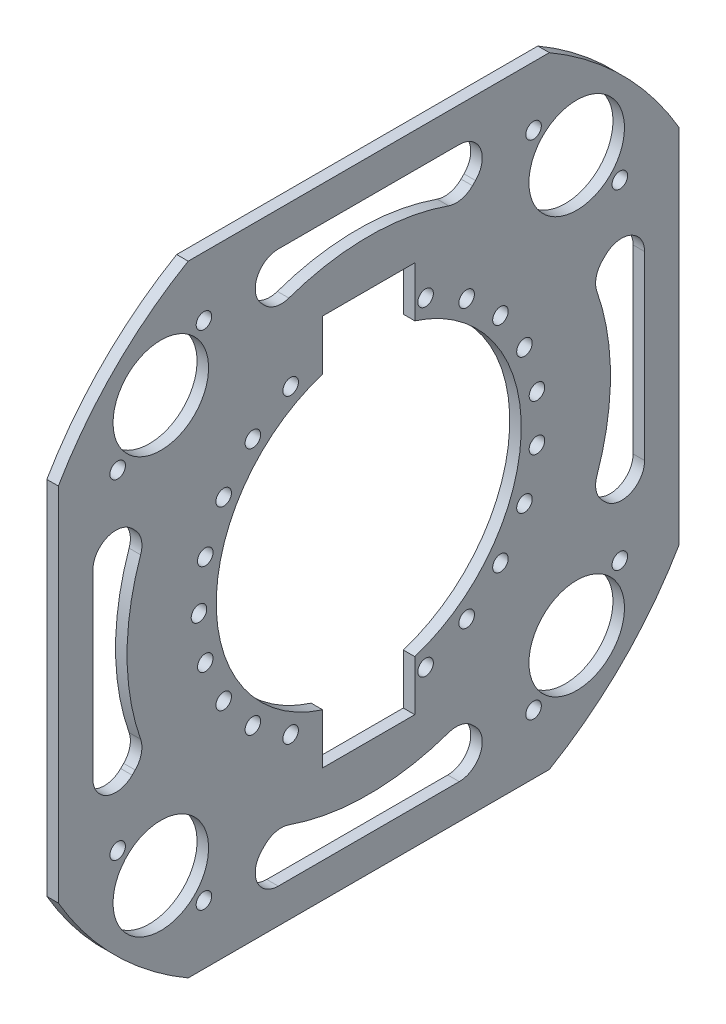
from build123d import *

# Parameters (mm, degrees)
ESQUISSE1_R        = 210
ESQUISSE1_R_2      = 6.75
BOSS_EXTRU_1_DEPTH = 10
ESQUISSE2_R        = 41.5
ESQUISSE2_R_2      = 6.75
BOSS_EXTRU_2_DEPTH = 10
BOSS_EXTRU_3_DEPTH = 10
CONG_1_R           = 20


with BuildPart() as part:
    # Esquisse1 → Boss.-Extru.1 (new body)
    with BuildSketch(Plane(origin=(0, 0, 0), x_dir=(0, 0, -1), z_dir=(1, 0, 0))):
        Circle(ESQUISSE1_R)
        with Locations((-147.5, 0)):
            Circle(ESQUISSE1_R_2, mode=Mode.SUBTRACT)
        with Locations((-142.030299884, 39.795023746)):
            Circle(ESQUISSE1_R_2, mode=Mode.SUBTRACT)
        with Locations((-126.026862171, 76.63863263)):
            Circle(ESQUISSE1_R_2, mode=Mode.SUBTRACT)
        with Locations((-100.676588625, 107.798304731)):
            Circle(ESQUISSE1_R_2, mode=Mode.SUBTRACT)
        with Locations((-67.859593065, 130.963069714)):
            Circle(ESQUISSE1_R_2, mode=Mode.SUBTRACT)
        with Locations((49.394742795, 138.983486013)):
            Circle(ESQUISSE1_R_2, mode=Mode.SUBTRACT)
        with Locations((85.060347512, 120.503059219)):
            Circle(ESQUISSE1_R_2, mode=Mode.SUBTRACT)
        with Locations((114.417415379, 93.085471788)):
            Circle(ESQUISSE1_R_2, mode=Mode.SUBTRACT)
        with Locations((135.288666972, 58.764160752)):
            Circle(ESQUISSE1_R_2, mode=Mode.SUBTRACT)
        with Locations((146.12617704, 20.084580742)):
            Circle(ESQUISSE1_R_2, mode=Mode.SUBTRACT)
        with Locations((146.12617704, -20.084580742)):
            Circle(ESQUISSE1_R_2, mode=Mode.SUBTRACT)
        with Locations((135.288666972, -58.764160752)):
            Circle(ESQUISSE1_R_2, mode=Mode.SUBTRACT)
        with Locations((114.417415379, -93.085471788)):
            Circle(ESQUISSE1_R_2, mode=Mode.SUBTRACT)
        with Locations((85.060347512, -120.503059219)):
            Circle(ESQUISSE1_R_2, mode=Mode.SUBTRACT)
        with Locations((49.394742795, -138.983486013)):
            Circle(ESQUISSE1_R_2, mode=Mode.SUBTRACT)
        with Locations((-67.859593065, -130.963069714)):
            Circle(ESQUISSE1_R_2, mode=Mode.SUBTRACT)
        with Locations((-100.676588625, -107.798304731)):
            Circle(ESQUISSE1_R_2, mode=Mode.SUBTRACT)
        with Locations((-126.026862171, -76.63863263)):
            Circle(ESQUISSE1_R_2, mode=Mode.SUBTRACT)
        with Locations((-142.030299884, -39.795023746)):
            Circle(ESQUISSE1_R_2, mode=Mode.SUBTRACT)
        with BuildLine():
            Line((40, -130), (40, -126.318050967))
            ThreePointArc((40, -126.318050967), (132.5, 0), (40, 126.318050967))
            Line((40, 126.318050967), (40, 130))
            Line((40, 130), (40, 170))
            Line((40, 170), (-40, 170))
            Line((-40, 170), (-40, 130))
            Line((-40, 130), (-40, 126.318050967))
            ThreePointArc((-40, 126.318050967), (-132.5, 0), (-40, -126.318050967))
            Line((-40, -126.318050967), (-40, -130))
            Line((-40, -130), (-40, -170))
            Line((-40, -170), (40, -170))
            Line((40, -170), (40, -130))
        make_face(mode=Mode.SUBTRACT)
    extrude(amount=BOSS_EXTRU_1_DEPTH)

    # Esquisse2 → Boss.-Extru.2 (add)
    # profile 1 of 4: a face of its own
    with BuildSketch(Plane.ZY):
        with BuildLine():
            Line((-156.896697906, -269.680229505), (-80.976239027, -193.759770626))
            ThreePointArc((-80.976239027, -193.759770626), (-148.492424049, -148.492424049), (-193.759770626, -80.976239027))
            Line((-193.759770626, -80.976239027), (-269.680229505, -156.896697906))
            ThreePointArc((-269.680229505, -156.896697906), (-220.61731573, -220.61731573), (-156.896697906, -269.680229505))
        make_face()
        with Locations((-180.665782593, -180.665782593)):
            Circle(ESQUISSE2_R, mode=Mode.SUBTRACT)
        with Locations((-143.18912319, -218.142441996)):
            Circle(ESQUISSE2_R_2, mode=Mode.SUBTRACT)
        with Locations((-218.142441996, -143.18912319)):
            Circle(ESQUISSE2_R_2, mode=Mode.SUBTRACT)
    # profile 2 of 4: a face of its own
    with BuildSketch(Plane.ZY):
        with BuildLine():
            Line((80.976239027, -193.759770626), (156.896697906, -269.680229505))
            ThreePointArc((156.896697906, -269.680229505), (220.61731573, -220.61731573), (269.680229505, -156.896697906))
            Line((269.680229505, -156.896697906), (193.759770626, -80.976239027))
            ThreePointArc((193.759770626, -80.976239027), (148.492424049, -148.492424049), (80.976239027, -193.759770626))
        make_face()
        with Locations((143.18912319, -218.142441996)):
            Circle(ESQUISSE2_R_2, mode=Mode.SUBTRACT)
        with Locations((180.665782593, -180.665782593)):
            Circle(ESQUISSE2_R, mode=Mode.SUBTRACT)
        with Locations((218.142441996, -143.18912319)):
            Circle(ESQUISSE2_R_2, mode=Mode.SUBTRACT)
    # profile 3 of 4: a face of its own
    with BuildSketch(Plane.ZY):
        with BuildLine():
            Line((-269.680229505, 156.896697906), (-193.759770626, 80.976239027))
            ThreePointArc((-193.759770626, 80.976239027), (-148.492424049, 148.492424049), (-80.976239027, 193.759770626))
            Line((-80.976239027, 193.759770626), (-156.896697906, 269.680229505))
            ThreePointArc((-156.896697906, 269.680229505), (-220.61731573, 220.61731573), (-269.680229505, 156.896697906))
        make_face()
        with Locations((-218.142441996, 143.18912319)):
            Circle(ESQUISSE2_R_2, mode=Mode.SUBTRACT)
        with Locations((-180.665782593, 180.665782593)):
            Circle(ESQUISSE2_R, mode=Mode.SUBTRACT)
        with Locations((-143.18912319, 218.142441996)):
            Circle(ESQUISSE2_R_2, mode=Mode.SUBTRACT)
    # profile 4 of 4: a face of its own
    with BuildSketch(Plane.ZY):
        with BuildLine():
            ThreePointArc((269.680229505, 156.896697906), (220.61731573, 220.61731573), (156.896697906, 269.680229505))
            Line((156.896697906, 269.680229505), (80.976239027, 193.759770626))
            ThreePointArc((80.976239027, 193.759770626), (148.492424049, 148.492424049), (193.759770626, 80.976239027))
            Line((193.759770626, 80.976239027), (269.680229505, 156.896697906))
        make_face()
        with Locations((218.142441996, 143.18912319)):
            Circle(ESQUISSE2_R_2, mode=Mode.SUBTRACT)
        with Locations((143.18912319, 218.142441996)):
            Circle(ESQUISSE2_R_2, mode=Mode.SUBTRACT)
        with Locations((180.665782593, 180.665782593)):
            Circle(ESQUISSE2_R, mode=Mode.SUBTRACT)
    extrude(amount=-BOSS_EXTRU_2_DEPTH)

    # Esquisse3 → Boss.-Extru.3 (add)
    with BuildSketch(Plane(origin=(10, 0, 0), x_dir=(0, 0, -1), z_dir=(1, 0, 0))):
        Polygon((-156.896697906, -269.680229505), (156.896697906, -269.680229505), (126.896697906, -239.680229505), (-126.896697906, -239.680229505), align=None)
        Polygon((-269.680229505, -156.896697906), (-269.680229505, 156.896697906), (-239.680229505, 126.896697906), (-239.680229505, -126.896697906), align=None)
        Polygon((-156.896697906, 269.680229505), (156.896697906, 269.680229505), (126.896697906, 239.680229505), (-126.896697906, 239.680229505), align=None)
        Polygon((269.680229505, 156.896697906), (269.680229505, -156.896697906), (239.680229505, -126.896697906), (239.680229505, 126.896697906), align=None)
    extrude(amount=-BOSS_EXTRU_3_DEPTH)

    # Congé1
    cong_1_edges = [part.edges().sort_by_distance(p)[0] for p in [
        (5, -193.759770626, 80.976239027),
        (5, -80.976239027, 193.759770626),
        (5, 80.976239027, 193.759770626),
        (5, 193.759770626, 80.976239027),
        (5, 193.759770626, -80.976239027),
        (5, 80.976239027, -193.759770626),
        (5, -80.976239027, -193.759770626),
        (5, -193.759770626, -80.976239027),
        (5, -239.680229505, 126.896697906),
        (5, -239.680229505, -126.896697906),
        (5, -126.896697906, 239.680229505),
        (5, 126.896697906, 239.680229505),
        (5, 239.680229505, 126.896697906),
        (5, 239.680229505, -126.896697906),
        (5, 126.896697906, -239.680229505),
        (5, -126.896697906, -239.680229505),
    ]]
    fillet(cong_1_edges, radius=CONG_1_R)


solid = part.part
